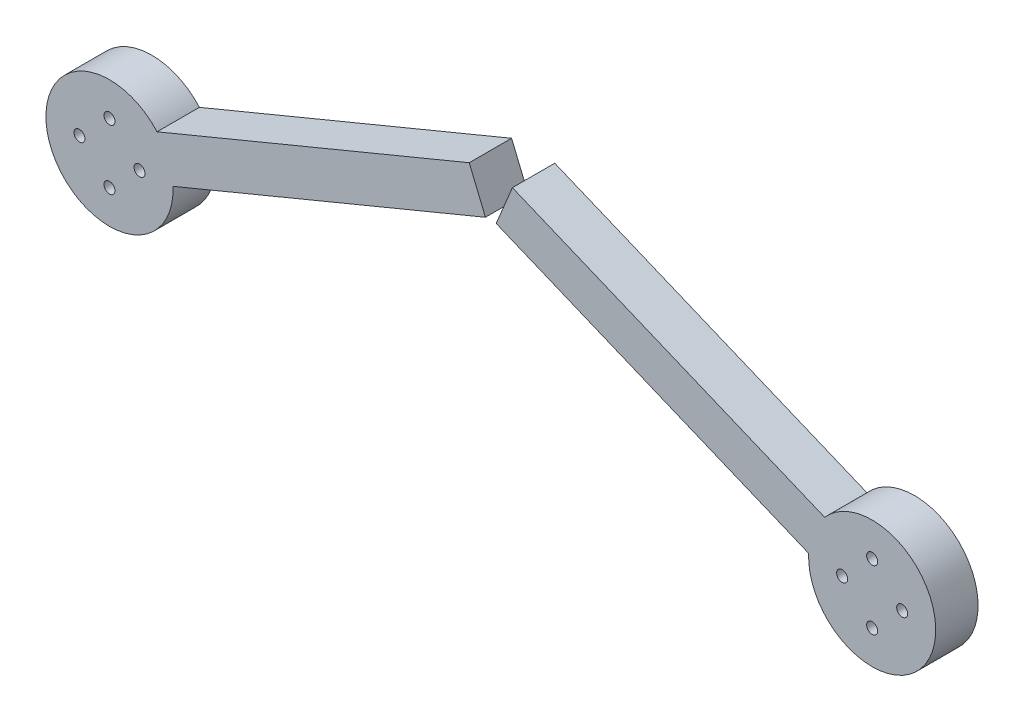
from build123d import *

# Parameters (mm, degrees)
BOSS_EXTRUDE1_DEPTH  = 25.4
M6_CLEARANCE_HOLE1_D = 6.6
CIRPATTERN1_COUNT    = 4
MIRROR3_COPY_1_D     = 6.6
MIRROR3_COPY_2_D     = 6.6
MIRROR3_COPY_3_D     = 6.6


with BuildPart() as part:
    # Sketch1 → Boss-Extrude1 (new body)
    with BuildSketch(Plane.XY):
        with BuildLine():
            Line((-206.337690312, -120.40336768), (-216.057849494, -96.936827554))
            Line((-216.057849494, -96.936827554), (-200.090704327, -90.323019474))
            ThreePointArc((-200.090704327, -90.323019474), (-264.221722061, -129.114871524), (-190.5, -115.598107213))
            ThreePointArc((-190.5, -115.598107213), (-190.509922275, -114.728636762), (-190.53968393, -113.859619178))
            Line((-190.53968393, -113.859619178), (-206.337690312, -120.40336768))
        make_face()
        with BuildLine():
            Line((-200.090704327, -90.323019474), (-216.057849494, -96.936827554))
            Line((-216.057849494, -96.936827554), (-206.337690312, -120.40336768))
            Line((-206.337690312, -120.40336768), (-190.53968393, -113.859619178))
            ThreePointArc((-190.53968393, -113.859619178), (-193.296017458, -101.271948737), (-200.090704327, -90.323019474))
        make_face()
        with BuildLine():
            Line((-12.941914653, -12.803452609), (-200.090704327, -90.323019474))
            ThreePointArc((-200.090704327, -90.323019474), (-193.296017458, -101.271948737), (-190.53968393, -113.859619178))
            Line((-190.53968393, -113.859619178), (-3.221755471, -36.269992735))
            Line((-3.221755471, -36.269992735), (-12.941914653, -12.803452609))
        make_face()
        with BuildLine():
            Line((200.090704327, -90.323019474), (12.941914653, -12.803452609))
            Line((12.941914653, -12.803452609), (3.221755471, -36.269992735))
            Line((3.221755471, -36.269992735), (190.53968393, -113.859619178))
            ThreePointArc((190.53968393, -113.859619178), (193.296017458, -101.271948737), (200.090704327, -90.323019474))
        make_face()
        with BuildLine():
            ThreePointArc((266.7, -115.598107213), (242.116764311, -79.976385153), (200.090704327, -90.323019474))
            Line((200.090704327, -90.323019474), (216.057849494, -96.936827554))
            Line((216.057849494, -96.936827554), (206.337690312, -120.40336768))
            Line((206.337690312, -120.40336768), (190.53968393, -113.859619178))
            ThreePointArc((190.53968393, -113.859619178), (227.730529549, -153.688184939), (266.7, -115.598107213))
        make_face()
        with BuildLine():
            Line((216.057849494, -96.936827554), (200.090704327, -90.323019474))
            ThreePointArc((200.090704327, -90.323019474), (193.296017458, -101.271948737), (190.53968393, -113.859619178))
            Line((190.53968393, -113.859619178), (206.337690312, -120.40336768))
            Line((206.337690312, -120.40336768), (216.057849494, -96.936827554))
        make_face()
    extrude(amount=BOSS_EXTRUDE1_DEPTH)

    # M6 Clearance Hole1 (through all)
    with Locations(Plane(origin=(-228.6, -97.598107272, 0), x_dir=(-1, 0, 0), z_dir=(0, 0, -1))):
        with Locations((0, 0)):
            m6_clearance_hole1 = Hole(M6_CLEARANCE_HOLE1_D / 2)

    # CirPattern1: M6 Clearance Hole1 ×4 about axis
    cirpattern1_axis = Axis((-228.6, -115.598107213, 0), (0, 0, 1))
    for i in range(1, CIRPATTERN1_COUNT):
        add(m6_clearance_hole1.rotate(cirpattern1_axis, i * 360 / CIRPATTERN1_COUNT), mode=Mode.SUBTRACT)

    # Mirror3: M6 Clearance Hole1 across plane
    add(m6_clearance_hole1.mirror(Plane(origin=(0, 0, 0), x_dir=(0, 0, 1), z_dir=(1, 0, 0))), mode=Mode.SUBTRACT)

    # Mirror3 copy 1 (through all)
    with Locations(Plane(origin=(246.599999941, -115.598107213, 0), x_dir=(0, -1, 0), z_dir=(0, 0, -1))):
        with Locations((0, 0)):
            Hole(MIRROR3_COPY_1_D / 2)

    # Mirror3 copy 2 (through all)
    with Locations(Plane(origin=(228.6, -133.598107155, 0), x_dir=(-1, 0, 0), z_dir=(0, 0, -1))):
        with Locations((0, 0)):
            Hole(MIRROR3_COPY_2_D / 2)

    # Mirror3 copy 3 (through all)
    with Locations(Plane(origin=(210.600000059, -115.598107213, 0), x_dir=(0, 1, 0), z_dir=(0, 0, -1))):
        with Locations((0, 0)):
            Hole(MIRROR3_COPY_3_D / 2)


solid = part.part
